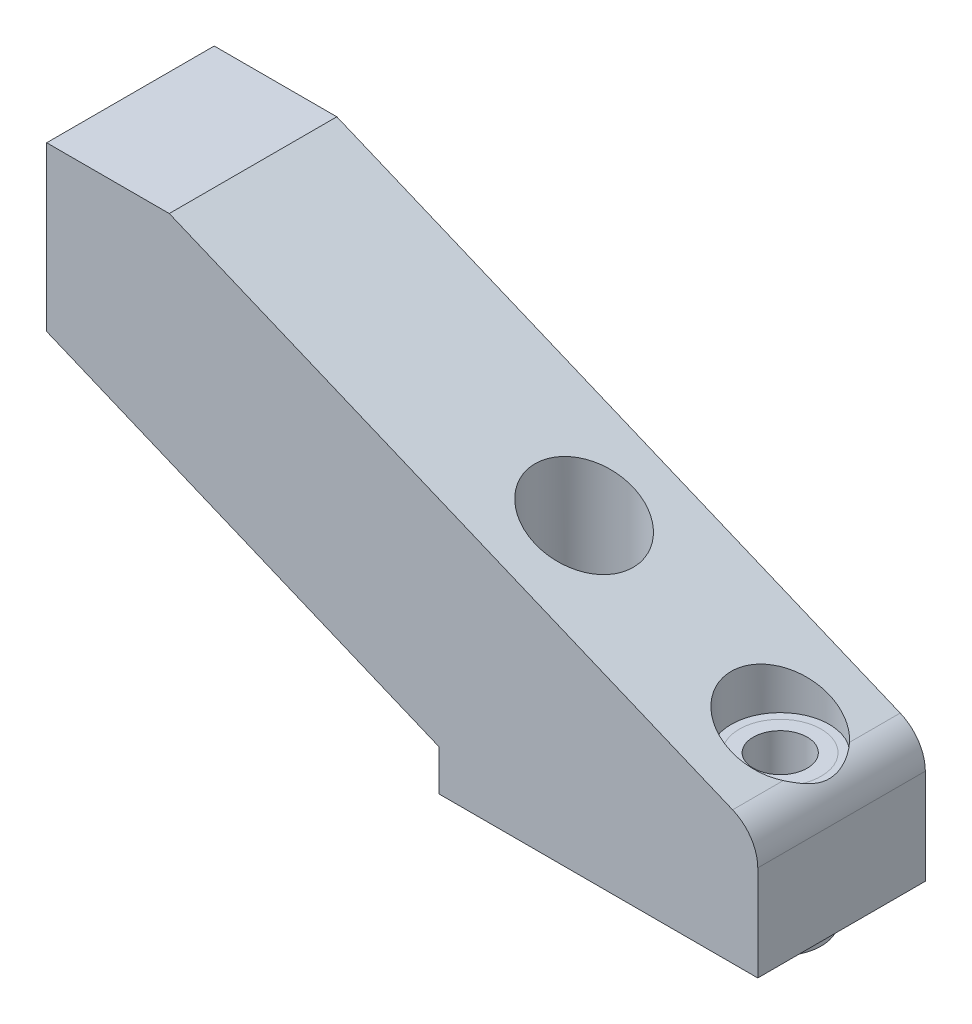
from build123d import *

# Parameters (mm, degrees)
BOSS_EXTRUDE1_DEPTH     = 20.5
CUT_EXTRUDE1_DEPTH      = 98.924715981
CUT_EXTRUDE1_DEPTH_BACK = 10
SKETCH2_R               = 3.3
SKETCH3_R               = 6
CUT_EXTRUDE2_DEPTH      = 30
SKETCH4_R               = 5
SKETCH4_R_2             = 3.25
BOSS_EXTRUDE2_DEPTH     = 3


with BuildPart() as part:
    # Sketch1 → Boss-Extrude1 (new body)
    with BuildSketch(Plane.XY):
        with BuildLine():
            Line((0, 0), (0, 6.666666667))
            ThreePointArc((0, 6.666666667), (-0.839748528, 9.440167648), (-3.076923077, 11.282051282))
            Line((-3.076923077, 11.282051282), (-72, 40))
            Line((-72, 40), (-87, 40))
            Line((-87, 40), (-87, 20))
            Line((-87, 20), (-39, 0))
            Line((-39, 0), (-39, -5))
            Line((-39, -5), (0, -5))
            Line((0, -5), (0, 0))
        make_face()
    extrude(amount=BOSS_EXTRUDE1_DEPTH)

    # Sketch2 → Cut-Extrude1 (cut, two sides: drawn at the far end of the back side and taken through both)
    with BuildSketch(Plane(origin=(0, 0, 0), x_dir=(1, 0, 0), z_dir=(0, 1, 0)).offset(-CUT_EXTRUDE1_DEPTH_BACK)):
        with Locations(Location((-7.5, -10.25, 0), (0, 0, 270))):
            Circle(SKETCH2_R)
        with Locations(Location((-31.5, -10.25, 0), (0, 0, 270))):
            Circle(SKETCH2_R)
    extrude(amount=CUT_EXTRUDE1_DEPTH + CUT_EXTRUDE1_DEPTH_BACK, mode=Mode.SUBTRACT)

    # Sketch3 → Cut-Extrude2 (cut)
    with BuildSketch(Plane(origin=(0, 40, 0), x_dir=(1, 0, 0), z_dir=(0, 1, 0))):
        with Locations(Location((-7.5, -10.25, 0), (0, 0, 270))):
            Circle(SKETCH3_R)
        with Locations(Location((-31.5, -10.25, 0), (0, 0, 270))):
            Circle(SKETCH3_R)
    extrude(amount=-CUT_EXTRUDE2_DEPTH, mode=Mode.SUBTRACT)

    # Sketch4 → Boss-Extrude2 (add)
    # profile 1 of 2: a face of its own
    with BuildSketch(Plane.XZ.offset(5)):
        with Locations(Location((-31.5, 10.25, 0), (0, 0, 90))):
            Circle(SKETCH4_R)
        with Locations(Location((-31.5, 10.25, 0), (0, 0, 270))):
            Circle(SKETCH4_R_2, mode=Mode.SUBTRACT)
    # profile 2 of 2: a face of its own
    with BuildSketch(Plane.XZ.offset(5)):
        with Locations(Location((-7.5, 10.25, 0), (0, 0, 90))):
            Circle(SKETCH4_R)
        with Locations(Location((-7.5, 10.25, 0), (0, 0, 270))):
            Circle(SKETCH4_R_2, mode=Mode.SUBTRACT)
    extrude(amount=BOSS_EXTRUDE2_DEPTH)


solid = part.part
